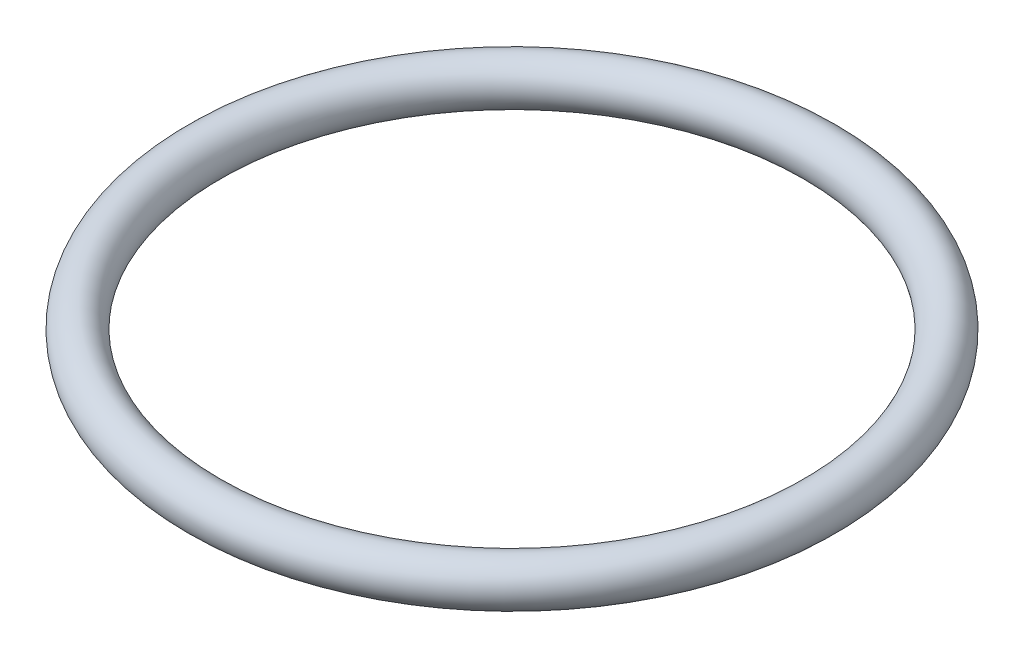
from build123d import *

# Parameters (mm, degrees)
SKETCH2_R = 0.5


with BuildPart() as part:
    # Sketch2 → Revolve1 (revolve)
    with BuildSketch(Plane.XY, mode=Mode.PRIVATE) as revolve1_sk:
        with Locations((6.9, 0)):
            Circle(SKETCH2_R)
    revolve(revolve1_sk.sketch.rotate(Axis((0, 0, 0), (0, 1, 0)), 90), axis=Axis((0, 0, 0), (0, 1, 0)))


solid = part.part
